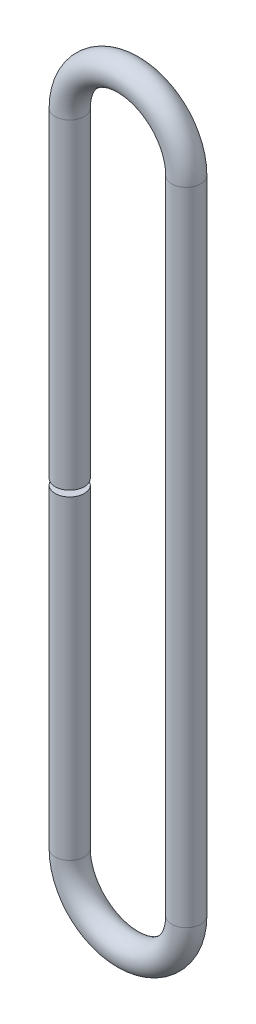
from build123d import *

# Parameters (mm, degrees)
SKETCH2_R = 0.5


with BuildPart() as part:
    # Sweep1: sweep along a path in Sketch1
    with BuildLine(Plane.XY) as sweep1_path:
        Line((0, 0.1), (0, 11.1))
        ThreePointArc((0, 11.1), (2, 13.1), (4, 11.1))
        Line((4, 11.1), (4, -10.9))
        ThreePointArc((4, -10.9), (2, -12.9), (0, -10.9))
        Line((0, -10.9), (0, -0.1))
    # Sketch2 → Sweep1 (sweep)
    with BuildSketch(Plane(origin=(0, 0.1, 0), x_dir=(1, 0, 0), z_dir=(0, 1, 0))):
        Circle(SKETCH2_R)
    sweep(path=sweep1_path.line)


solid = part.part
